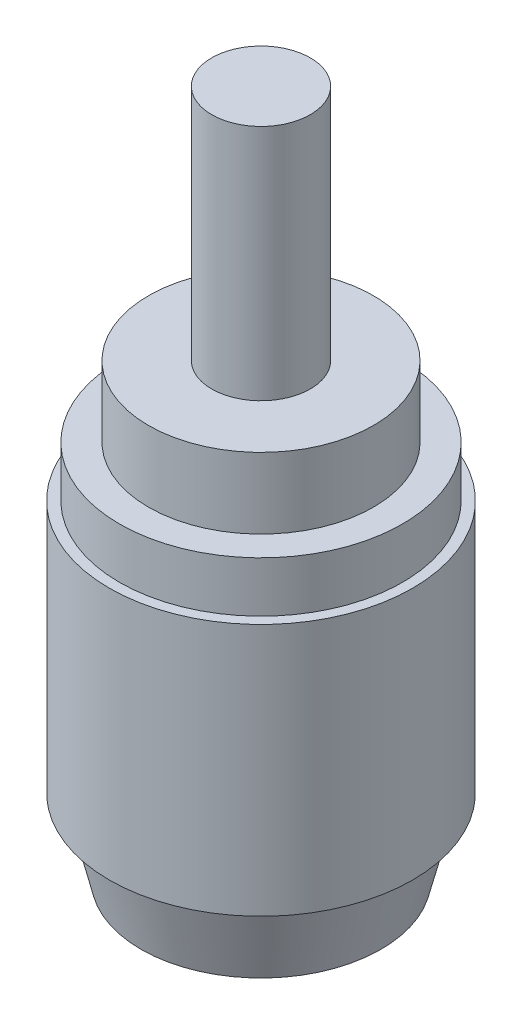
from build123d import *

# Parameters (mm, degrees)
SKETCH_2_R      = 4.45
EXTRUDE_1_DEPTH = 2.8
SKETCH_3_R      = 1.95
EXTRUDE_2_DEPTH = 9.4


with BuildPart() as part:
    # 草图1 → 旋转1 (revolve)
    with BuildSketch(Plane.XY, mode=Mode.PRIVATE) as revolve_1_sk:
        Polygon((0, 0), (4.75, 0), (5.5, 3), (6, 3), (6, 13), (5.6, 13), (5.6, 15), (0, 15), align=None)
    revolve(revolve_1_sk.sketch.rotate(Axis((0, 15.733998589, 0), (0, -1, 0)), 90), axis=Axis((0, 15.733998589, 0), (0, -1, 0)))

    # 草图2 → 凸台-拉伸1 (add)
    with BuildSketch(Plane(origin=(0, 15, 0), x_dir=(1, 0, 0), z_dir=(0, 1, 0))):
        with Locations(Location((0, 0, 0), (0, 0, 270))):
            Circle(SKETCH_2_R)
    extrude(amount=EXTRUDE_1_DEPTH)

    # 草图3 → 凸台-拉伸2 (add)
    with BuildSketch(Plane(origin=(0, 17.8, 0), x_dir=(1, 0, 0), z_dir=(0, 1, 0))):
        with Locations(Location((0, 0, 0), (0, 0, 270))):
            Circle(SKETCH_3_R)
    extrude(amount=EXTRUDE_2_DEPTH)


solid = part.part
